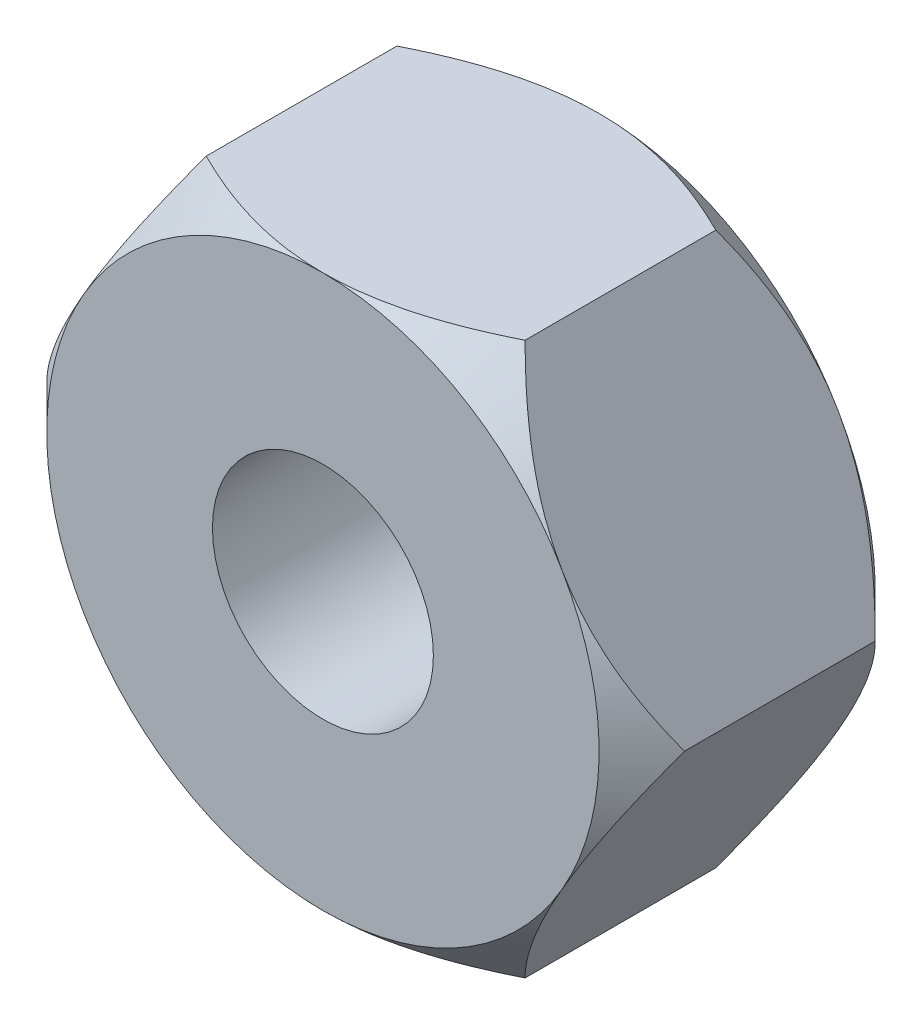
from build123d import *

# Parameters (mm, degrees)
IZIM1_R                     = 2
Y_KSEKLIK_EKSTR_ZYON1_DEPTH = 5
IZIM2_OUTSIDE_W             = 18.762
IZIM2_OUTSIDE_H             = 17.214
IZIM2_OUTSIDE_R             = 5
KES_EKSTR_ZYON1_DEPTH       = 1
KES_EKSTR_ZYON1_DRAFT       = -45
IZIM3_OUTSIDE_W             = 18.762
IZIM3_OUTSIDE_H             = 17.214
IZIM3_OUTSIDE_R             = 5
KES_EKSTR_ZYON2_DEPTH       = 1
KES_EKSTR_ZYON2_DRAFT       = -45


with BuildPart() as part:
    # Çizim1 → Yükseklik-Ekstrüzyon1 (new body)
    with BuildSketch(Plane.XY):
        Polygon((5.773502692, 0), (2.886751346, 5), (-2.886751346, 5), (-5.773502692, 0), (-2.886751346, -5), (2.886751346, -5), align=None)
        Circle(IZIM1_R, mode=Mode.SUBTRACT)
    extrude(amount=Y_KSEKLIK_EKSTR_ZYON1_DEPTH)


with BuildPart() as kes_ekstr_zyon1_tool:
    # Çizim2 outside → Kes-Ekstrüzyon1 (with draft: the straight prism first)
    with BuildSketch(Plane.XY.offset(5)):
        Rectangle(IZIM2_OUTSIDE_W, IZIM2_OUTSIDE_H)
        Circle(IZIM2_OUTSIDE_R, mode=Mode.SUBTRACT)
    extrude(amount=-KES_EKSTR_ZYON1_DEPTH)
    # Kes-Ekstrüzyon1: the draft: its side faces are tilted about the plane it starts from
    kes_ekstr_zyon1_sides = [kes_ekstr_zyon1_tool.faces().sort_by_distance(p)[0] for p in [
        (0, -8.607, 4.5),
        (9.381, 0, 4.5),
        (0, 8.607, 4.5),
        (-9.381, 0, 4.5),
        (-5, 0, 4.5),
    ]]
    draft(kes_ekstr_zyon1_sides, Plane.XY.offset(5), KES_EKSTR_ZYON1_DRAFT)


with BuildPart() as part_1:
    add(part.part)

    # Kes-Ekstrüzyon1: cut by kes_ekstr_zyon1_tool
    add(kes_ekstr_zyon1_tool.part, mode=Mode.SUBTRACT)


with BuildPart() as kes_ekstr_zyon2_tool:
    # Çizim3 outside → Kes-Ekstrüzyon2 (with draft: the straight prism first)
    with BuildSketch(Plane(origin=(0, 0, 0), x_dir=(-1, 0, 0), z_dir=(0, 0, -1))):
        Rectangle(IZIM3_OUTSIDE_W, IZIM3_OUTSIDE_H)
        Circle(IZIM3_OUTSIDE_R, mode=Mode.SUBTRACT)
    extrude(amount=-KES_EKSTR_ZYON2_DEPTH)
    # Kes-Ekstrüzyon2: the draft: its side faces are tilted about the plane it starts from
    kes_ekstr_zyon2_sides = [kes_ekstr_zyon2_tool.faces().sort_by_distance(p)[0] for p in [
        (0, -8.607, 0.5),
        (-9.381, 0, 0.5),
        (0, 8.607, 0.5),
        (9.381, 0, 0.5),
        (5, 0, 0.5),
    ]]
    draft(kes_ekstr_zyon2_sides, Plane(origin=(0, 0, 0), x_dir=(-1, 0, 0), z_dir=(0, 0, -1)), KES_EKSTR_ZYON2_DRAFT)


with BuildPart() as part_2:
    add(part_1.part)

    # Kes-Ekstrüzyon2: cut by kes_ekstr_zyon2_tool
    add(kes_ekstr_zyon2_tool.part, mode=Mode.SUBTRACT)


solid = part_2.part
